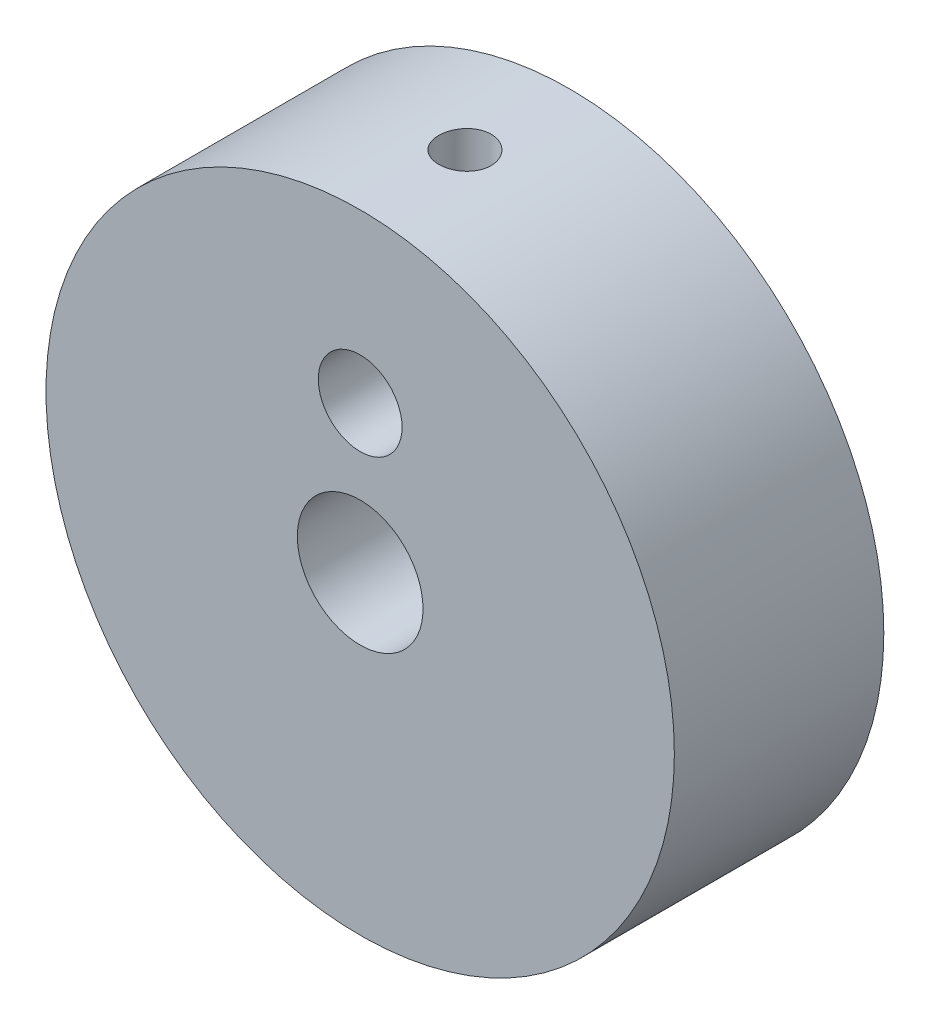
from build123d import *

# Parameters (mm, degrees)
SKETCH_1_R          = 15
EXTRUDE_1_DEPTH     = 10
SKETCH_3_R          = 3
CUT_EXTRUDE_1_DEPTH = 24.452078799
SKETCH_2_R          = 2
CUT_EXTRUDE_2_DEPTH = 24.452078799
M3X0_5_1_REACH      = 35.912
M3X0_5_1_BORE_R     = 1.25
M3X0_5_2_REACH      = 35.912
M3X0_5_2_BORE_R     = 1.25


with BuildPart() as part:
    # ｽｹｯﾁ1 → ﾎﾞｽ - 押し出し1 (new body)
    with BuildSketch(Plane.XY):
        Circle(SKETCH_1_R)
    extrude(amount=EXTRUDE_1_DEPTH)

    # ｽｹｯﾁ3 → ｶｯﾄ - 押し出し1 (cut, through all)
    with BuildSketch(Plane(origin=(0, 0, 0), x_dir=(-1, 0, 0), z_dir=(0, 0, -1))):
        Circle(SKETCH_3_R)
    extrude(amount=-CUT_EXTRUDE_1_DEPTH, mode=Mode.SUBTRACT)

    # ｽｹｯﾁ2 → ｶｯﾄ - 押し出し2 (cut, through all)
    with BuildSketch(Plane.XY.offset(10)):
        with Locations((0, 7)):
            Circle(SKETCH_2_R)
    extrude(amount=-CUT_EXTRUDE_2_DEPTH, mode=Mode.SUBTRACT)

    # M3x0.5 ねじ穴1 bore (on position points) → M3x0.5 ねじ穴1 (cut, up to next)
    with BuildSketch(Plane(origin=(0, 15, 5), x_dir=(1, 0, 0), z_dir=(0, 1, 0)), mode=Mode.PRIVATE) as m3x0_5_1_sk1:
        Circle(M3X0_5_1_BORE_R)
    m3x0_5_1_tool1 = extrude(m3x0_5_1_sk1.sketch, amount=-M3X0_5_1_REACH, mode=Mode.PRIVATE) & part.part
    add(m3x0_5_1_tool1.solids().sort_by_distance((0, 15, 5))[0], mode=Mode.SUBTRACT)

    # M3x0.5 ねじ穴2 bore (on position points) → M3x0.5 ねじ穴2 (cut, up to next)
    with BuildSketch(Plane(origin=(0, -15, 5), x_dir=(-1, 0, 0), z_dir=(0, -1, 0)), mode=Mode.PRIVATE) as m3x0_5_2_sk1:
        Circle(M3X0_5_2_BORE_R)
    m3x0_5_2_tool1 = extrude(m3x0_5_2_sk1.sketch, amount=-M3X0_5_2_REACH, mode=Mode.PRIVATE) & part.part
    add(m3x0_5_2_tool1.solids().sort_by_distance((0, -15, 5))[0], mode=Mode.SUBTRACT)


solid = part.part
